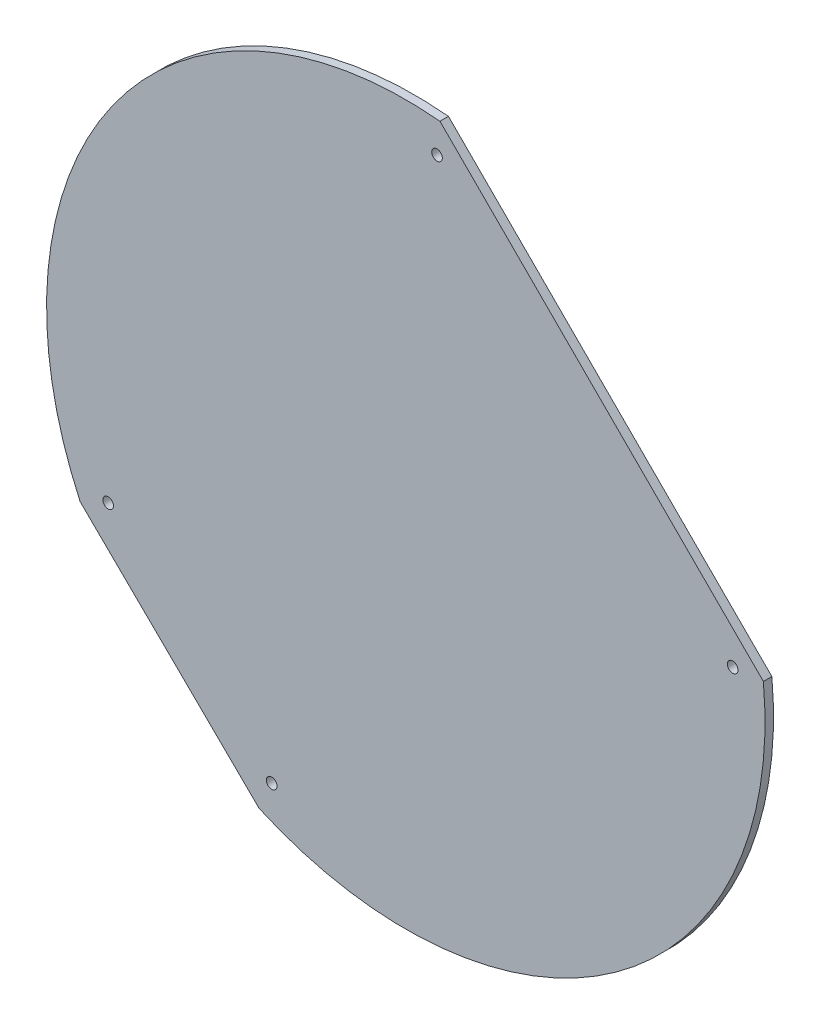
from build123d import *

# Parameters (mm, degrees)
ESBO_O1_R                = 1.25
RESSALTO_EXTRUS_O1_DEPTH = 2


with BuildPart() as part:
    # Esboço1 → Ressalto-extrusão1 (new body)
    with BuildSketch(Plane.XY):
        with BuildLine():
            Line((64.019528598, 84.846815111), (84.16137873, 64.704964979))
            ThreePointArc((84.16137873, 64.704964979), (49.309954929, -12.012204688), (-34.522641382, -20.511713992))
            Line((-34.522641382, -20.511713992), (-76.621548101, 20.929016434))
            ThreePointArc((-76.621548101, 20.929016434), (-69.061916809, 105.430734899), (8.041603414, 140.824740295))
            Line((8.041603414, 140.824740295), (28.423773233, 120.442570476))
            Line((28.423773233, 120.442570476), (64.019528598, 84.846815111))
        make_face()
        with Locations((-31.557799421, -13.88383463)):
            Circle(ESBO_O1_R, mode=Mode.SUBTRACT)
        with Locations((7.350981773, 133.596869623)):
            Circle(ESBO_O1_R, mode=Mode.SUBTRACT)
        with Locations((76.933508058, 64.014343338)):
            Circle(ESBO_O1_R, mode=Mode.SUBTRACT)
        with Locations((-70.041206278, 23.99792083)):
            Circle(ESBO_O1_R, mode=Mode.SUBTRACT)
    extrude(amount=RESSALTO_EXTRUS_O1_DEPTH)


solid = part.part
